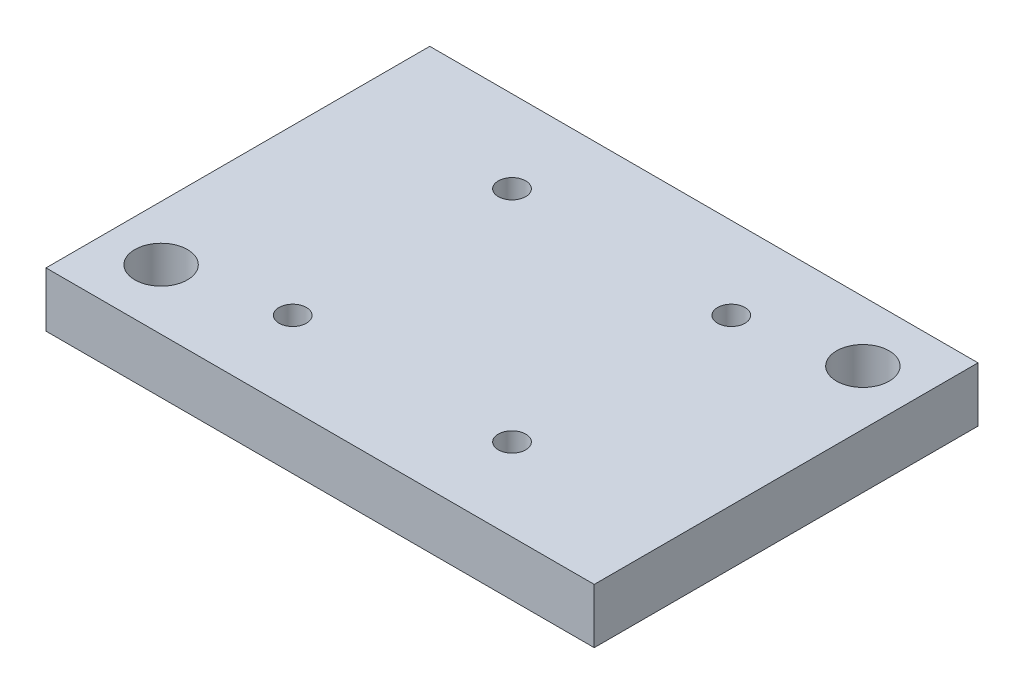
from build123d import *

# Parameters (mm, degrees)
ESQUISSE1_W                               = 50
ESQUISSE1_H                               = 35
BOSS_EXTRU_1_DEPTH                        = 5
TROU_POUR_TARAUDAGE_POUR_TROU_TARAUD_M3_D = 2.5
D_GAGEMENT_M43_D                          = 4.8


with BuildPart() as part:
    # Esquisse1 → Boss.-Extru.1 (new body)
    with BuildSketch(Plane(origin=(0, 0, 0), x_dir=(1, 0, 0), z_dir=(0, 1, 0))):
        with Locations((6.571428571, -2.357142857)):
            Rectangle(ESQUISSE1_W, ESQUISSE1_H)
    extrude(amount=BOSS_EXTRU_1_DEPTH)

    # Trou pour taraudage pour trou taraudé M33 (through all)
    with Locations(Plane(origin=(0, 5, 0), x_dir=(1, 0, 0), z_dir=(0, 1, 0))):
        with Locations((16.571428571, 7.642857143), (-3.428571429, 7.642857143), (16.571428571, -12.357142857), (-3.428571429, -12.357142857)):
            Hole(TROU_POUR_TARAUDAGE_POUR_TROU_TARAUD_M3_D / 2)

    # Dégagement M43 (through all)
    with Locations(Plane(origin=(0, 5, 0), x_dir=(1, 0, 0), z_dir=(0, 1, 0))):
        with Locations((26.571428571, 9.642857143), (-13.428571429, -14.357142857)):
            Hole(D_GAGEMENT_M43_D / 2)


solid = part.part
